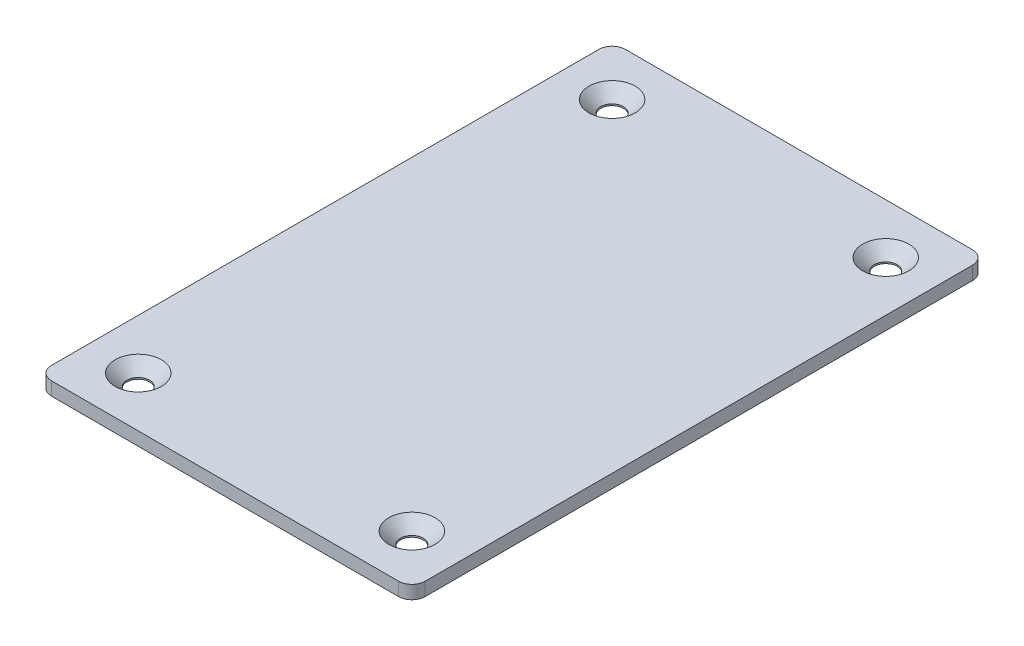
from build123d import *

# Parameters (mm, degrees)
SKIZZE1_W                                   = 56
SKIZZE1_H                                   = 86
AUFSATZ_LINEAR_AUSTRAGEN1_DEPTH             = 2
VERRUNDUNG1_R                               = 2
FORMSENKUNG_F_R_M3_SENKSCHRAUBE_MIT_2_COUNT = 2
FORMSENKUNG_F_R_M3_SENKSCHRAUBE_MIT_2_PITCH = 81.987803971
FORMSENKUNG_F_R_M3_SENKSCHRAUBE_MIT_3_COUNT = 2
FORMSENKUNG_F_R_M3_SENKSCHRAUBE_MIT_3_PITCH = 71
FORMSENKUNG_F_R_M3_SENKSCHRAUBE_MIT_4_COUNT = 2
FORMSENKUNG_F_R_M3_SENKSCHRAUBE_MIT_4_PITCH = 41


with BuildPart() as part:
    # Skizze1 → Aufsatz-Linear austragen1 (new body)
    with BuildSketch(Plane(origin=(0, 0, 0), x_dir=(1, 0, 0), z_dir=(0, 1, 0))):
        with Locations((28, 43)):
            Rectangle(SKIZZE1_W, SKIZZE1_H)
    extrude(amount=AUFSATZ_LINEAR_AUSTRAGEN1_DEPTH)

    # Verrundung1
    verrundung1_edges = [part.edges().sort_by_distance(p)[0] for p in [
        (0, 1, -86),
        (56, 1, -86),
        (56, 1, 0),
        (0, 1, 0),
    ]]
    fillet(verrundung1_edges, radius=VERRUNDUNG1_R)

    # Skizze3 → Formsenkung für M3 Senkschraube mit Innensechskant1 (revolve, cut)
    with BuildSketch(Plane(origin=(7.5, 2, -7.5), x_dir=(0, 0, 1), z_dir=(1, 0, 0))):
        Polygon((0, 0), (0, 2), (1.7, 2), (1.7, 1.77), (3.47, 0), align=None)
    formsenkung_f_r_m3_senkschraube_mit_inne = revolve(axis=Axis((7.5, 8.35, -7.5), (0, -1, 0)), mode=Mode.SUBTRACT)

    # Formsenkung f_r M3 Senkschraube mit  2: Formsenkung für M3 Senkschraube mit Innensechskant1 ×2
    with Locations(*[Vector(0.5000743770922673, 0, -0.865982457891487) * (i * FORMSENKUNG_F_R_M3_SENKSCHRAUBE_MIT_2_PITCH) for i in range(1, FORMSENKUNG_F_R_M3_SENKSCHRAUBE_MIT_2_COUNT)]):
        add(formsenkung_f_r_m3_senkschraube_mit_inne, mode=Mode.SUBTRACT)

    # Formsenkung f_r M3 Senkschraube mit  3: Formsenkung für M3 Senkschraube mit Innensechskant1 ×2
    with Locations(*[(0, 0, -i * FORMSENKUNG_F_R_M3_SENKSCHRAUBE_MIT_3_PITCH) for i in range(1, FORMSENKUNG_F_R_M3_SENKSCHRAUBE_MIT_3_COUNT)]):
        add(formsenkung_f_r_m3_senkschraube_mit_inne, mode=Mode.SUBTRACT)

    # Formsenkung f_r M3 Senkschraube mit  4: Formsenkung für M3 Senkschraube mit Innensechskant1 ×2
    with Locations(*[(i * FORMSENKUNG_F_R_M3_SENKSCHRAUBE_MIT_4_PITCH, 0, 0) for i in range(1, FORMSENKUNG_F_R_M3_SENKSCHRAUBE_MIT_4_COUNT)]):
        add(formsenkung_f_r_m3_senkschraube_mit_inne, mode=Mode.SUBTRACT)


solid = part.part
